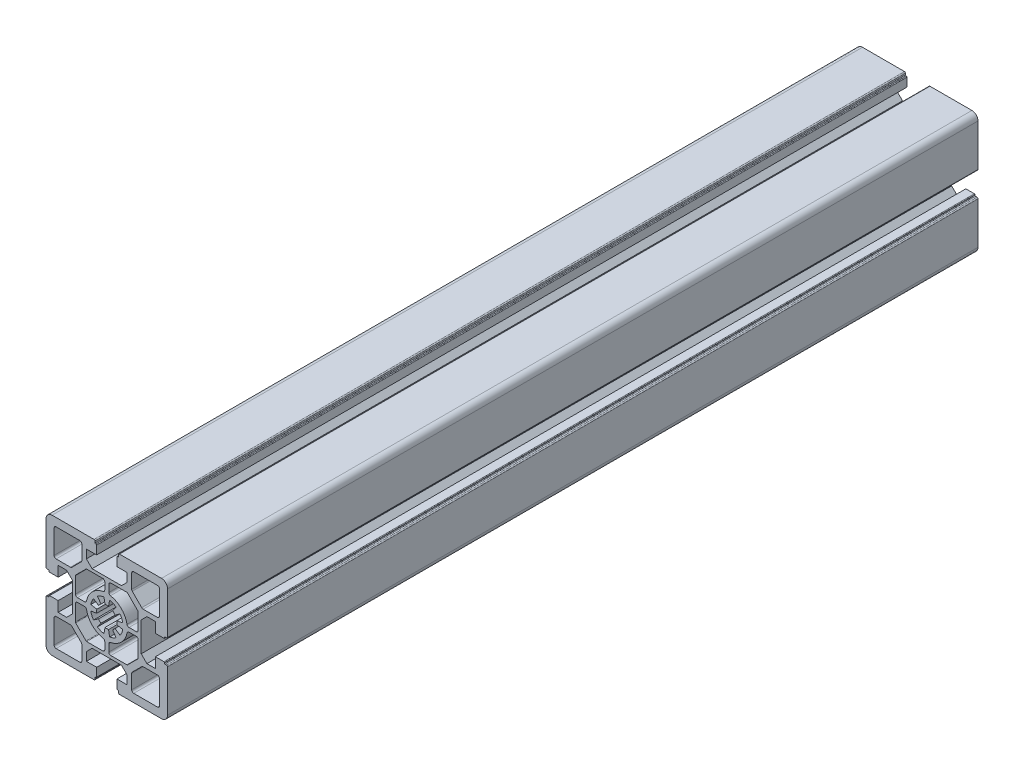
from build123d import *

# Parameters (mm, degrees)
BASE_EXTRUDE_DEPTH = 400
ESCALA1_SCALE      = 0.5


with BuildPart() as part:
    # Sketch1 → Base-Extrude (new body)
    with BuildSketch(Plane.XY):
        with BuildLine():
            Line((7.24997588, 17.000014817), (-2.412e-05, 17.000014817))
            Line((-2.412e-05, 17.000014817), (-7.25002412, 17.000014817))
            Line((-7.25002412, 17.000014817), (-10.05002512, 19.800013819))
            Line((-10.05002512, 19.800013819), (-10.05002512, 24.000014819))
            Line((-10.05002512, 24.000014819), (-5.00002412, 24.000014819))
            Line((-5.00002412, 24.000014819), (-5.00002412, 28.20002069))
            ThreePointArc((-5.00002412, 28.20002069), (-5.08789044, 28.41214864), (-5.300018455, 28.500014819))
            Line((-5.300018455, 28.500014819), (-5.500021455, 28.500014819))
            ThreePointArc((-5.500021455, 28.500014819), (-5.712152769, 28.587882347), (-5.800020455, 28.800013596))
            Line((-5.800020455, 28.800013596), (-5.800020455, 29.500015192))
            ThreePointArc((-5.800020455, 29.500015192), (-5.946466955, 29.853568318), (-6.300020081, 30.000014817))
            Line((-6.300020081, 30.000014817), (-27.000022696, 30.000014817))
            ThreePointArc((-27.000022696, 30.000014817), (-29.121341455, 29.121335817), (-30.000020455, 27.000017059))
            Line((-30.000020455, 27.000017059), (-30.000020455, 6.300013444))
            ThreePointArc((-30.000020455, 6.300013444), (-29.853573955, 5.946460317), (-29.500020828, 5.800013817))
            Line((-29.500020828, 5.800013817), (-28.800019731, 5.800013817))
            ThreePointArc((-28.800019731, 5.800013817), (-28.587888208, 5.712146064), (-28.500020455, 5.500014542))
            Line((-28.500020455, 5.500014542), (-28.500020455, 5.300014093))
            ThreePointArc((-28.500020455, 5.300014093), (-28.412152701, 5.087882571), (-28.200021179, 5.000014817))
            Line((-28.200021179, 5.000014817), (-24.000020455, 5.000014817))
            Line((-24.000020455, 5.000014817), (-24.000020455, 10.050012866))
            Line((-24.000020455, 10.050012866), (-19.800019665, 10.050012866))
            Line((-19.800019665, 10.050012866), (-17.000019665, 7.250013866))
            Line((-17.000019665, 7.250013866), (-17.000019665, 4.3167e-05))
            Line((-17.000019665, 4.3167e-05), (-17.000019665, -7.249956831))
            Line((-17.000019665, -7.249956831), (-19.800019665, -10.049955831))
            Line((-19.800019665, -10.049955831), (-24.000020455, -10.049955831))
            Line((-24.000020455, -10.049955831), (-24.000020455, -4.999957783))
            Line((-24.000020455, -4.999957783), (-28.200021179, -4.999957783))
            ThreePointArc((-28.200021179, -4.999957783), (-28.412152701, -5.087825536), (-28.500020455, -5.299957058))
            Line((-28.500020455, -5.299957058), (-28.500020455, -5.499957507))
            ThreePointArc((-28.500020455, -5.499957507), (-28.587888208, -5.712089029), (-28.800019731, -5.799956783))
            Line((-28.800019731, -5.799956783), (-29.500020828, -5.799956783))
            ThreePointArc((-29.500020828, -5.799956783), (-29.853573955, -5.946403283), (-30.000020455, -6.299956409))
            Line((-30.000020455, -6.299956409), (-30.000020455, -26.999960024))
            ThreePointArc((-30.000020455, -26.999960024), (-29.121341455, -29.121278783), (-27.000022696, -29.999957783))
            Line((-27.000022696, -29.999957783), (-6.300020081, -29.999957783))
            ThreePointArc((-6.300020081, -29.999957783), (-5.946466955, -29.853511283), (-5.800020455, -29.499958157))
            Line((-5.800020455, -29.499958157), (-5.800020455, -28.799956561))
            ThreePointArc((-5.800020455, -28.799956561), (-5.712152769, -28.587825312), (-5.500021455, -28.499957784))
            Line((-5.500021455, -28.499957784), (-5.300018455, -28.499957784))
            ThreePointArc((-5.300018455, -28.499957784), (-5.08789044, -28.412091605), (-5.00002412, -28.199963655))
            Line((-5.00002412, -28.199963655), (-5.00002412, -23.999957784))
            Line((-5.00002412, -23.999957784), (-10.05002512, -23.999957784))
            Line((-10.05002512, -23.999957784), (-10.05002512, -19.799956784))
            Line((-10.05002512, -19.799956784), (-7.25002412, -16.999957783))
            Line((-7.25002412, -16.999957783), (-2.412e-05, -16.999957783))
            Line((-2.412e-05, -16.999957783), (7.24997588, -16.999957783))
            Line((7.24997588, -16.999957783), (10.04997688, -19.799956784))
            Line((10.04997688, -19.799956784), (10.04997688, -23.999957784))
            Line((10.04997688, -23.999957784), (4.99997588, -23.999957784))
            Line((4.99997588, -23.999957784), (4.99997588, -28.199963655))
            ThreePointArc((4.99997588, -28.199963655), (5.0878422, -28.412091605), (5.299970215, -28.499957784))
            Line((5.299970215, -28.499957784), (5.499973215, -28.499957784))
            ThreePointArc((5.499973215, -28.499957784), (5.71210453, -28.587825312), (5.799972216, -28.799956561))
            Line((5.799972216, -28.799956561), (5.799972216, -29.499958157))
            ThreePointArc((5.799972216, -29.499958157), (5.946418716, -29.853511283), (6.299971842, -29.999957783))
            Line((6.299971842, -29.999957783), (26.999974457, -29.999957783))
            ThreePointArc((26.999974457, -29.999957783), (29.121293215, -29.121278783), (29.999972215, -26.999960024))
            Line((29.999972215, -26.999960024), (29.999972215, -6.299956409))
            ThreePointArc((29.999972215, -6.299956409), (29.853525715, -5.946403283), (29.499972589, -5.799956783))
            Line((29.499972589, -5.799956783), (28.799971491, -5.799956783))
            ThreePointArc((28.799971491, -5.799956783), (28.587839969, -5.712089029), (28.499972215, -5.499957507))
            Line((28.499972215, -5.499957507), (28.499972215, -5.299957058))
            ThreePointArc((28.499972215, -5.299957058), (28.412104462, -5.087825536), (28.199972939, -4.999957783))
            Line((28.199972939, -4.999957783), (23.999972215, -4.999957783))
            Line((23.999972215, -4.999957783), (23.999972215, -10.049955831))
            Line((23.999972215, -10.049955831), (19.799971426, -10.049955831))
            Line((19.799971426, -10.049955831), (16.999971426, -7.249956831))
            Line((16.999971426, -7.249956831), (16.999971426, 4.3167e-05))
            Line((16.999971426, 4.3167e-05), (16.999971426, 7.250013866))
            Line((16.999971426, 7.250013866), (19.799971426, 10.050012866))
            Line((19.799971426, 10.050012866), (23.999972215, 10.050012866))
            Line((23.999972215, 10.050012866), (23.999972215, 5.000014817))
            Line((23.999972215, 5.000014817), (28.199972939, 5.000014817))
            ThreePointArc((28.199972939, 5.000014817), (28.412104462, 5.087882571), (28.499972215, 5.300014093))
            Line((28.499972215, 5.300014093), (28.499972215, 5.500014542))
            ThreePointArc((28.499972215, 5.500014542), (28.587839969, 5.712146064), (28.799971491, 5.800013817))
            Line((28.799971491, 5.800013817), (29.499972589, 5.800013817))
            ThreePointArc((29.499972589, 5.800013817), (29.853525715, 5.946460317), (29.999972215, 6.300013444))
            Line((29.999972215, 6.300013444), (29.999972215, 27.000017059))
            ThreePointArc((29.999972215, 27.000017059), (29.121293215, 29.121335817), (26.999974457, 30.000014817))
            Line((26.999974457, 30.000014817), (6.299971842, 30.000014817))
            ThreePointArc((6.299971842, 30.000014817), (5.946418716, 29.853568318), (5.799972216, 29.500015192))
            Line((5.799972216, 29.500015192), (5.799972216, 28.800013596))
            ThreePointArc((5.799972216, 28.800013596), (5.71210453, 28.587882347), (5.499973215, 28.500014819))
            Line((5.499973215, 28.500014819), (5.299970215, 28.500014819))
            ThreePointArc((5.299970215, 28.500014819), (5.0878422, 28.41214864), (4.99997588, 28.20002069))
            Line((4.99997588, 28.20002069), (4.99997588, 24.000014819))
            Line((4.99997588, 24.000014819), (10.04997688, 24.000014819))
            Line((10.04997688, 24.000014819), (10.04997688, 19.800013819))
            Line((10.04997688, 19.800013819), (7.24997588, 17.000014817))
        make_face()
        with BuildLine():
            Line((24.999970687, 12.300015508), (17.964182773, 12.300015508))
            ThreePointArc((17.964182773, 12.300015508), (17.581498992, 12.376136067), (17.257075378, 12.59290907))
            Line((17.257075378, 12.59290907), (12.592863552, 17.257122896))
            ThreePointArc((12.592863552, 17.257122896), (12.376090508, 17.581546796), (12.29996994, 17.964230842))
            Line((12.29996994, 17.964230842), (12.29996994, 25.000017255))
            ThreePointArc((12.29996994, 25.000017255), (12.59286294, 25.707123508), (13.299969193, 26.000016508))
            Line((13.299969193, 26.000016508), (24.999970687, 26.000016508))
            ThreePointArc((24.999970687, 26.000016508), (25.70707694, 25.707123508), (25.99996994, 25.000017255))
            Line((25.99996994, 25.000017255), (25.99996994, 13.300014761))
            ThreePointArc((25.99996994, 13.300014761), (25.70707694, 12.592908508), (24.999970687, 12.300015508))
        make_face(mode=Mode.SUBTRACT)
        with BuildLine():
            Line((-0.868254781, 4.924047323), (-1.389203942, 7.878492919))
            ThreePointArc((-1.389203942, 7.878492919), (-3.061491097, 7.391065963), (-4.588639176, 6.553242527))
            Line((-4.588639176, 6.553242527), (-2.867900032, 4.095774325))
            ThreePointArc((-2.867900032, 4.095774325), (-3.535545186, 3.535556326), (-4.095767305, 2.867914629))
            Line((-4.095767305, 2.867914629), (-6.553231573, 4.588649719))
            ThreePointArc((-6.553231573, 4.588649719), (-7.391053065, 3.061505388), (-7.878479822, 1.389222571))
            Line((-7.878479822, 1.389222571), (-4.924052211, 0.868276934))
            ThreePointArc((-4.924052211, 0.868276934), (-5.000015145, 2.8517e-05), (-4.924052211, -0.8682199))
            Line((-4.924052211, -0.8682199), (-7.878479822, -1.389165536))
            ThreePointArc((-7.878479822, -1.389165536), (-7.391053065, -3.061448353), (-6.553231573, -4.588592684))
            Line((-6.553231573, -4.588592684), (-4.095767305, -2.867857594))
            ThreePointArc((-4.095767305, -2.867857594), (-3.535545186, -3.535499291), (-2.867900032, -4.09571729))
            Line((-2.867900032, -4.09571729), (-4.588639176, -6.553185492))
            ThreePointArc((-4.588639176, -6.553185492), (-3.061491097, -7.391008929), (-1.389203942, -7.878435884))
            Line((-1.389203942, -7.878435884), (-0.868254781, -4.923990288))
            ThreePointArc((-0.868254781, -4.923990288), (-0.435797618, -4.980922606), (-2.412e-05, -4.999947433))
            ThreePointArc((-2.412e-05, -4.999947433), (0.435749379, -4.980922606), (0.868206541, -4.923990288))
            Line((0.868206541, -4.923990288), (1.389155702, -7.878435884))
            ThreePointArc((1.389155702, -7.878435884), (3.061442857, -7.391008929), (4.588590936, -6.553185492))
            Line((4.588590936, -6.553185492), (2.867851793, -4.09571729))
            ThreePointArc((2.867851793, -4.09571729), (3.535496947, -3.535499291), (4.095719065, -2.867857594))
            Line((4.095719065, -2.867857594), (6.553183334, -4.588592684))
            ThreePointArc((6.553183334, -4.588592684), (7.391004826, -3.061448353), (7.878431582, -1.389165536))
            Line((7.878431582, -1.389165536), (4.924003972, -0.8682199))
            ThreePointArc((4.924003972, -0.8682199), (4.999966905, 2.8517e-05), (4.924003972, 0.868276934))
            Line((4.924003972, 0.868276934), (7.878431582, 1.389222571))
            ThreePointArc((7.878431582, 1.389222571), (7.391004826, 3.061505388), (6.553183334, 4.588649719))
            Line((6.553183334, 4.588649719), (4.095719065, 2.867914629))
            ThreePointArc((4.095719065, 2.867914629), (3.535496947, 3.535556326), (2.867851793, 4.095774325))
            Line((2.867851793, 4.095774325), (4.588590936, 6.553242527))
            ThreePointArc((4.588590936, 6.553242527), (3.061442857, 7.391065963), (1.389155702, 7.878492919))
            Line((1.389155702, 7.878492919), (0.868206541, 4.924047323))
            ThreePointArc((0.868206541, 4.924047323), (0.435749379, 4.980979641), (-2.412e-05, 5.000004467))
            ThreePointArc((-2.412e-05, 5.000004467), (-0.435797618, 4.980979641), (-0.868254781, 4.924047323))
        make_face(mode=Mode.SUBTRACT)
        with BuildLine():
            Line((14.499970687, 1.000016508), (10.969128525, 1.000016508))
            ThreePointArc((10.969128525, 1.000016508), (10.328572063, 1.232105996), (9.985348997, 1.820643198))
            ThreePointArc((9.985348997, 1.820643198), (7.177103386, 7.177150109), (1.820595849, 9.985394525))
            ThreePointArc((1.820595849, 9.985394525), (1.232058499, 10.328617545), (0.99996894, 10.969174093))
            Line((0.99996894, 10.969174093), (0.99996894, 14.500017255))
            ThreePointArc((0.99996894, 14.500017255), (1.29286194, 15.207123508), (1.999968193, 15.500016508))
            Line((1.999968193, 15.500016508), (9.900222627, 15.500016508))
            ThreePointArc((9.900222627, 15.500016508), (10.091564812, 15.461956186), (10.253776891, 15.353569557))
            Line((10.253776891, 15.353569557), (15.35352292, 10.253824528))
            ThreePointArc((15.35352292, 10.253824528), (15.461909599, 10.091612425), (15.49996994, 9.900270195))
            Line((15.49996994, 9.900270195), (15.49996994, 2.000015761))
            ThreePointArc((15.49996994, 2.000015761), (15.20707694, 1.292909508), (14.499970687, 1.000016508))
        make_face(mode=Mode.SUBTRACT)
        with BuildLine():
            Line((-25.000018927, -12.299958473), (-17.964231013, -12.299958473))
            ThreePointArc((-17.964231013, -12.299958473), (-17.581547231, -12.376079032), (-17.257123618, -12.592852035))
            Line((-17.257123618, -12.592852035), (-12.592911792, -17.257065861))
            ThreePointArc((-12.592911792, -17.257065861), (-12.376138748, -17.581489761), (-12.30001818, -17.964173807))
            Line((-12.30001818, -17.964173807), (-12.30001818, -24.99996022))
            ThreePointArc((-12.30001818, -24.99996022), (-12.59291118, -25.707066473), (-13.300017432, -25.999959473))
            Line((-13.300017432, -25.999959473), (-25.000018927, -25.999959473))
            ThreePointArc((-25.000018927, -25.999959473), (-25.70712518, -25.707066473), (-26.00001818, -24.99996022))
            Line((-26.00001818, -24.99996022), (-26.00001818, -13.299957726))
            ThreePointArc((-26.00001818, -13.299957726), (-25.70712518, -12.592851473), (-25.000018927, -12.299958473))
        make_face(mode=Mode.SUBTRACT)
        with BuildLine():
            Line((-14.500018927, -0.999959473), (-10.969176764, -0.999959473))
            ThreePointArc((-10.969176764, -0.999959473), (-10.328620302, -1.232048961), (-9.985397236, -1.820586163))
            ThreePointArc((-9.985397236, -1.820586163), (-7.177151626, -7.177093074), (-1.820644088, -9.98533749))
            ThreePointArc((-1.820644088, -9.98533749), (-1.232106738, -10.32856051), (-1.00001718, -10.969117058))
            Line((-1.00001718, -10.969117058), (-1.00001718, -14.49996022))
            ThreePointArc((-1.00001718, -14.49996022), (-1.29291018, -15.207066473), (-2.000016432, -15.499959473))
            Line((-2.000016432, -15.499959473), (-9.900270866, -15.499959473))
            ThreePointArc((-9.900270866, -15.499959473), (-10.091613051, -15.461899151), (-10.25382513, -15.353512523))
            Line((-10.25382513, -15.353512523), (-15.353571159, -10.253767494))
            ThreePointArc((-15.353571159, -10.253767494), (-15.461957839, -10.091555391), (-15.50001818, -9.90021316))
            Line((-15.50001818, -9.90021316), (-15.50001818, -1.999958726))
            ThreePointArc((-15.50001818, -1.999958726), (-15.20712518, -1.292852473), (-14.500018927, -0.999959473))
        make_face(mode=Mode.SUBTRACT)
        with BuildLine():
            Line((0.99996894, -10.969117058), (0.99996894, -14.49996022))
            ThreePointArc((0.99996894, -14.49996022), (1.29286194, -15.207066473), (1.999968193, -15.499959473))
            Line((1.999968193, -15.499959473), (9.900222627, -15.499959473))
            ThreePointArc((9.900222627, -15.499959473), (10.091564812, -15.461899151), (10.253776891, -15.353512523))
            Line((10.253776891, -15.353512523), (15.35352292, -10.253767494))
            ThreePointArc((15.35352292, -10.253767494), (15.461909599, -10.091555391), (15.49996994, -9.90021316))
            Line((15.49996994, -9.90021316), (15.49996994, -1.999958726))
            ThreePointArc((15.49996994, -1.999958726), (15.20707694, -1.292852473), (14.499970687, -0.999959473))
            Line((14.499970687, -0.999959473), (10.969128525, -0.999959473))
            ThreePointArc((10.969128525, -0.999959473), (10.328572063, -1.232048961), (9.985348997, -1.820586163))
            ThreePointArc((9.985348997, -1.820586163), (7.177103386, -7.177093074), (1.820595849, -9.98533749))
            ThreePointArc((1.820595849, -9.98533749), (1.232058499, -10.32856051), (0.99996894, -10.969117058))
        make_face(mode=Mode.SUBTRACT)
        with BuildLine():
            Line((-1.00001718, 10.969174093), (-1.00001718, 14.500017255))
            ThreePointArc((-1.00001718, 14.500017255), (-1.29291018, 15.207123508), (-2.000016432, 15.500016508))
            Line((-2.000016432, 15.500016508), (-9.900270866, 15.500016508))
            ThreePointArc((-9.900270866, 15.500016508), (-10.091613051, 15.461956186), (-10.25382513, 15.353569557))
            Line((-10.25382513, 15.353569557), (-15.353571159, 10.253824528))
            ThreePointArc((-15.353571159, 10.253824528), (-15.461957839, 10.091612425), (-15.50001818, 9.900270195))
            Line((-15.50001818, 9.900270195), (-15.50001818, 2.000015761))
            ThreePointArc((-15.50001818, 2.000015761), (-15.20712518, 1.292909508), (-14.500018927, 1.000016508))
            Line((-14.500018927, 1.000016508), (-10.969176764, 1.000016508))
            ThreePointArc((-10.969176764, 1.000016508), (-10.328620302, 1.232105996), (-9.985397236, 1.820643198))
            ThreePointArc((-9.985397236, 1.820643198), (-7.177151626, 7.177150109), (-1.820644088, 9.985394525))
            ThreePointArc((-1.820644088, 9.985394525), (-1.232106738, 10.328617545), (-1.00001718, 10.969174093))
        make_face(mode=Mode.SUBTRACT)
        with BuildLine():
            Line((-26.00001818, 13.300014761), (-26.00001818, 25.000017255))
            ThreePointArc((-26.00001818, 25.000017255), (-25.70712518, 25.707123508), (-25.000018927, 26.000016508))
            Line((-25.000018927, 26.000016508), (-13.300017432, 26.000016508))
            ThreePointArc((-13.300017432, 26.000016508), (-12.59291118, 25.707123508), (-12.30001818, 25.000017255))
            Line((-12.30001818, 25.000017255), (-12.30001818, 17.964230842))
            ThreePointArc((-12.30001818, 17.964230842), (-12.376138748, 17.581546796), (-12.592911792, 17.257122896))
            Line((-12.592911792, 17.257122896), (-17.257123618, 12.59290907))
            ThreePointArc((-17.257123618, 12.59290907), (-17.581547231, 12.376136067), (-17.964231013, 12.300015508))
            Line((-17.964231013, 12.300015508), (-25.000018927, 12.300015508))
            ThreePointArc((-25.000018927, 12.300015508), (-25.70712518, 12.592908508), (-26.00001818, 13.300014761))
        make_face(mode=Mode.SUBTRACT)
        with BuildLine():
            Line((25.99996994, -13.299957726), (25.99996994, -24.99996022))
            ThreePointArc((25.99996994, -24.99996022), (25.70707694, -25.707066473), (24.999970687, -25.999959473))
            Line((24.999970687, -25.999959473), (13.299969193, -25.999959473))
            ThreePointArc((13.299969193, -25.999959473), (12.59286294, -25.707066473), (12.29996994, -24.99996022))
            Line((12.29996994, -24.99996022), (12.29996994, -17.964173807))
            ThreePointArc((12.29996994, -17.964173807), (12.376090508, -17.581489761), (12.592863552, -17.257065861))
            Line((12.592863552, -17.257065861), (17.257075378, -12.592852035))
            ThreePointArc((17.257075378, -12.592852035), (17.581498992, -12.376079032), (17.964182773, -12.299958473))
            Line((17.964182773, -12.299958473), (24.999970687, -12.299958473))
            ThreePointArc((24.999970687, -12.299958473), (25.70707694, -12.592851473), (25.99996994, -13.299957726))
        make_face(mode=Mode.SUBTRACT)
    extrude(amount=-BASE_EXTRUDE_DEPTH)


with BuildPart() as part_1:
    # Escala1: scaled about (0, 0, 0)
    add(part.part.scale(ESCALA1_SCALE))


solid = part_1.part
